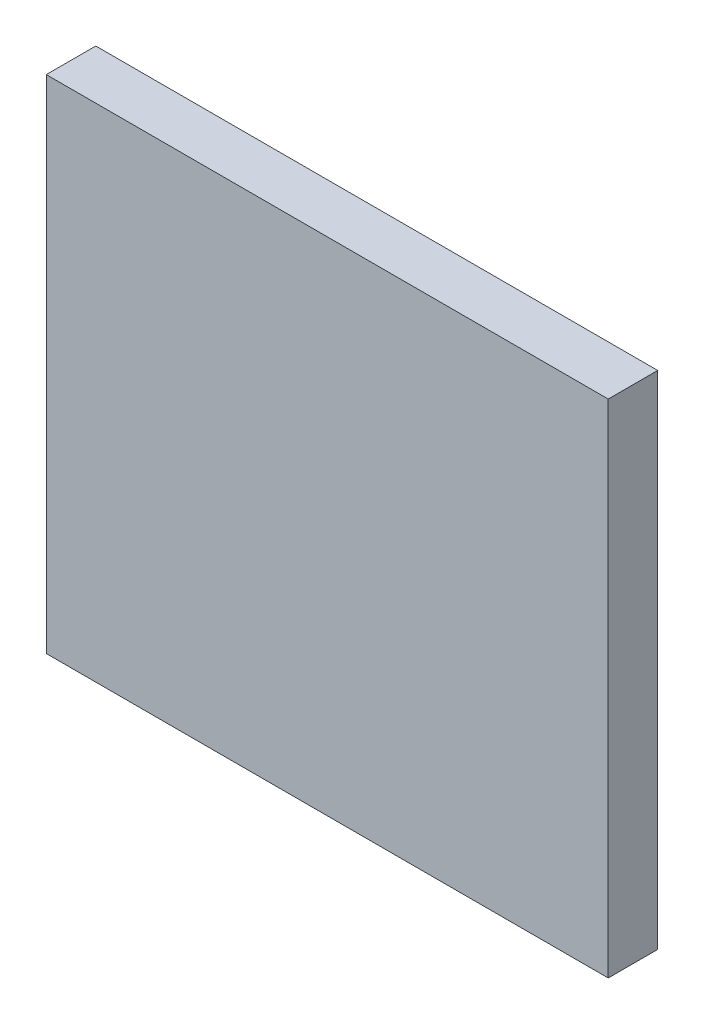
from build123d import *

# Parameters (mm, degrees)
SKETCH1_W               = 11.35
SKETCH1_H               = 10.127
COMPONENT_OUTLINE_DEPTH = 1


with BuildPart() as part:
    # Sketch1 → Component_Outline (new body)
    with BuildSketch(Plane.XY):
        with Locations((-0.675, -3.75)):
            Rectangle(SKETCH1_W, SKETCH1_H)
    extrude(amount=COMPONENT_OUTLINE_DEPTH)


solid = part.part
